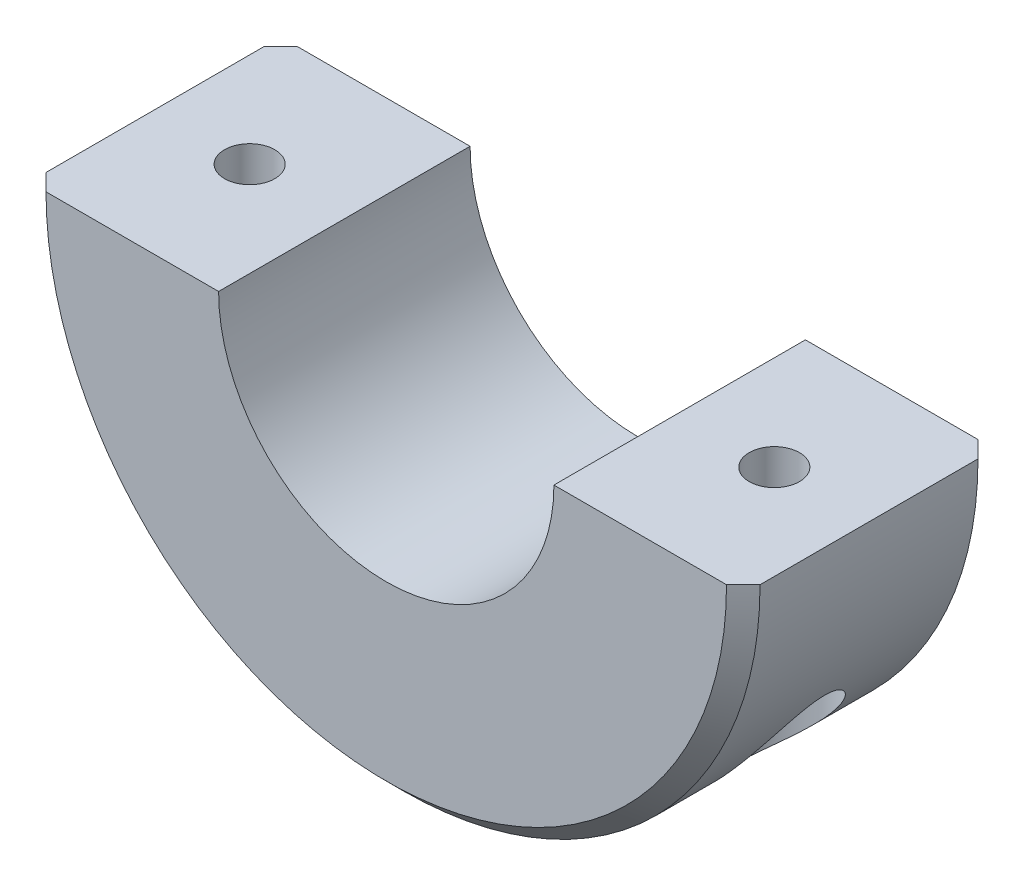
from build123d import *

# Parameters (mm, degrees)
EXTRUDE_1_DEPTH     = 15
SKETCH_2_R          = 1.5
CUT_EXTRUDE_1_DEPTH = 34
SKETCH_3_R          = 3
CUT_EXTRUDE_2_DEPTH = 18
CHAMFER_1_SIZE      = 1


with BuildPart() as part:
    # 草图1 → 凸台-拉伸1 (new body)
    with BuildSketch(Plane.XY):
        with BuildLine():
            Line((-21.295, 0), (-10, 0))
            ThreePointArc((-10, 0), (0, -10), (10, 0))
            Line((10, 0), (21.295, 0))
            ThreePointArc((21.295, 0), (0, -21.295), (-21.295, 0))
        make_face()
    extrude(amount=EXTRUDE_1_DEPTH)

    # 草图2 → 切除-拉伸1 (cut)
    with BuildSketch(Plane(origin=(0, 0, 0), x_dir=(1, 0, 0), z_dir=(0, 1, 0))):
        with Locations(Location((-15.6475, -7.5, 0), (0, 0, 270))):
            Circle(SKETCH_2_R)
        with Locations(Location((15.6475, -7.5, 0), (0, 0, 270))):
            Circle(SKETCH_2_R)
    extrude(amount=-CUT_EXTRUDE_1_DEPTH, mode=Mode.SUBTRACT)

    # 草图3 → 切除-拉伸2 (cut)
    with BuildSketch(Plane(origin=(0, -25, 0), x_dir=(1, 0, 0), z_dir=(0, 1, 0))):
        with Locations(Location((-15.6475, -7.5, 0), (0, 0, 90))):
            Circle(SKETCH_3_R)
        with Locations(Location((15.6475, -7.5, 0), (0, 0, 90))):
            Circle(SKETCH_3_R)
    extrude(amount=CUT_EXTRUDE_2_DEPTH, mode=Mode.SUBTRACT)

    # 倒角1
    chamfer_1_edges = [part.edges().sort_by_distance(p)[0] for p in [
        (0, -21.295, 15),
        (0, -21.295, 0),
    ]]
    chamfer(chamfer_1_edges, length=CHAMFER_1_SIZE)


solid = part.part
